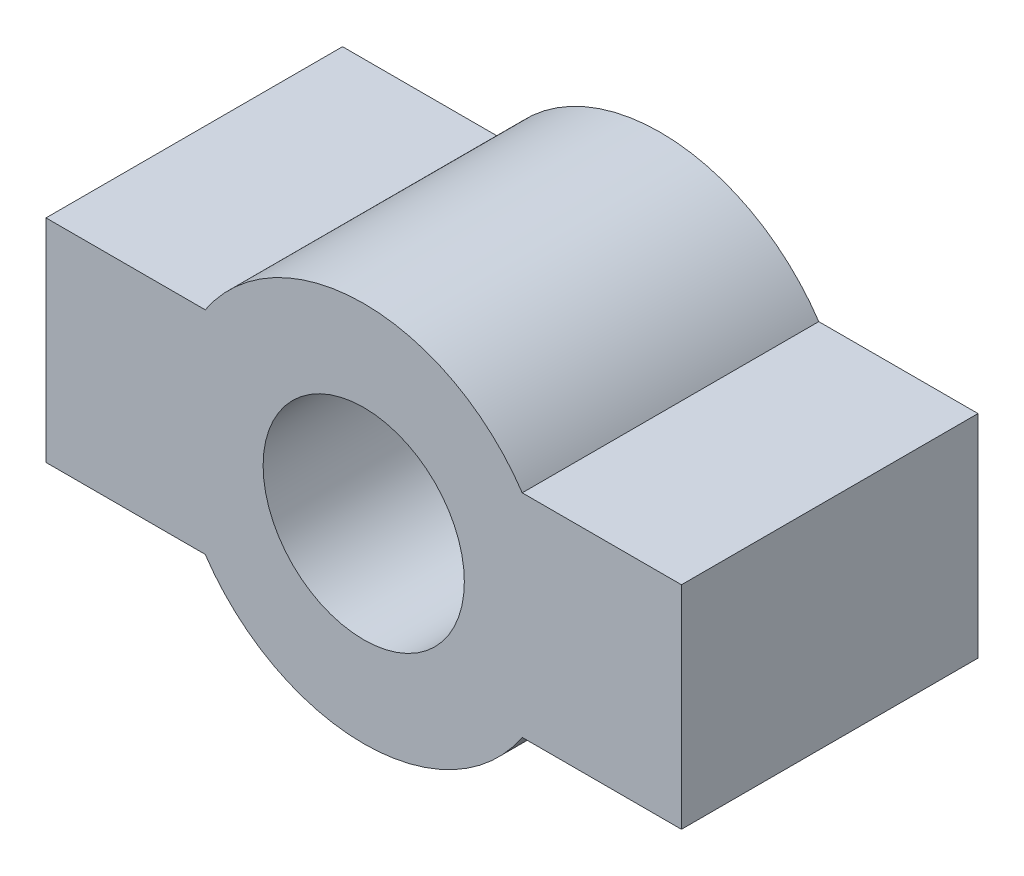
from build123d import *

# Parameters (mm, degrees)
SKETCH_1_R      = 9.5
EXTRUDE_1_DEPTH = 28


with BuildPart() as part:
    # 草图1 → 拉伸1 (new body)
    with BuildSketch(Plane.XY):
        with BuildLine():
            Line((14.966629547, 10), (30, 10))
            Line((30, 10), (30, -10))
            Line((30, -10), (14.966629547, -10))
            ThreePointArc((14.966629547, -10), (0, -18), (-14.966629547, -10))
            Line((-14.966629547, -10), (-30, -10))
            Line((-30, -10), (-30, 10))
            Line((-30, 10), (-14.966629547, 10))
            ThreePointArc((-14.966629547, 10), (0, 18), (14.966629547, 10))
        make_face()
        Circle(SKETCH_1_R, mode=Mode.SUBTRACT)
    extrude(amount=EXTRUDE_1_DEPTH)


solid = part.part
